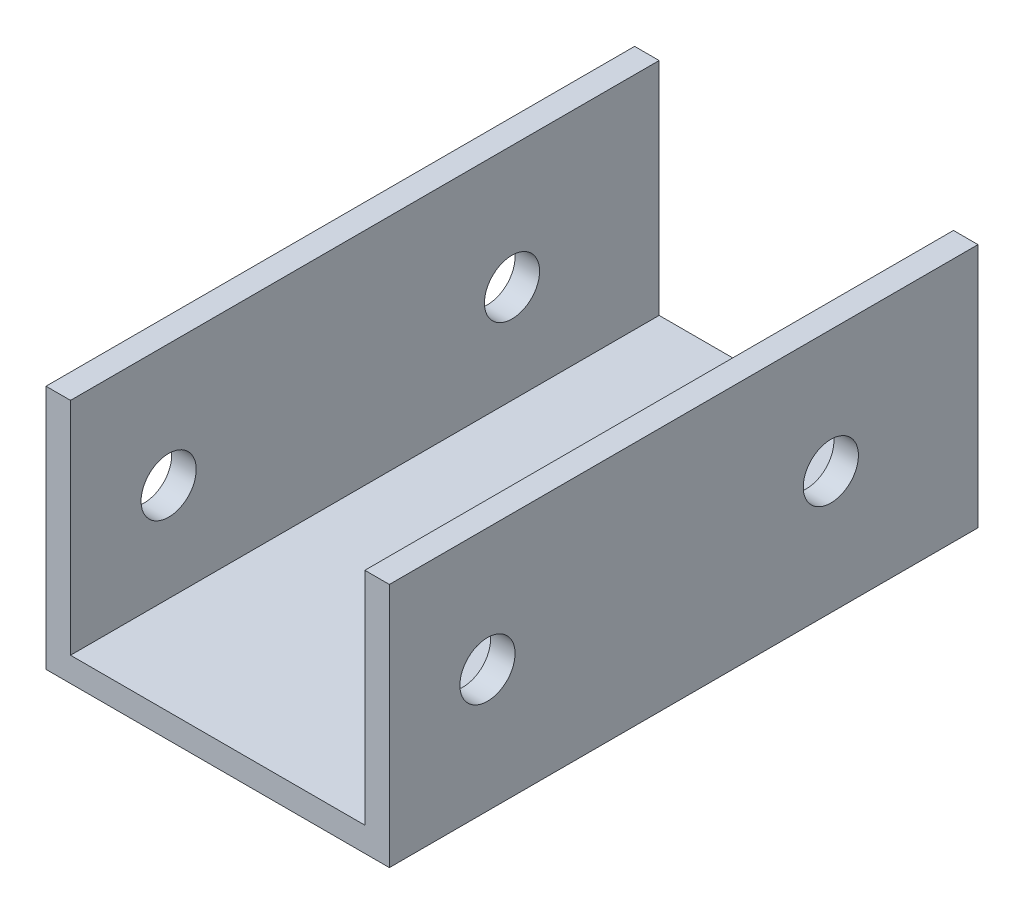
from build123d import *

# Parameters (mm, degrees)
BOSS_EXTRUDE1_DEPTH     = 76.2
F_1_4_CLEARANCE_HOLE1_D = 7.14248


with BuildPart() as part:
    # Sketch2 → Boss-Extrude1 (new body)
    with BuildSketch(Plane.XY):
        Polygon((-19.05, 15.875), (-22.225, 15.875), (-22.225, -15.875), (22.225, -15.875), (22.225, 15.875), (19.05, 15.875), (19.05, -12.7), (-19.05, -12.7), align=None)
    extrude(amount=BOSS_EXTRUDE1_DEPTH)

    # 1/4 Clearance Hole1 (through all)
    with Locations(Plane(origin=(22.225, 0, 0), x_dir=(0, 0, -1), z_dir=(1, 0, 0))):
        with Locations((-19.05, 0), (-63.5, 0)):
            Hole(F_1_4_CLEARANCE_HOLE1_D / 2)


solid = part.part
